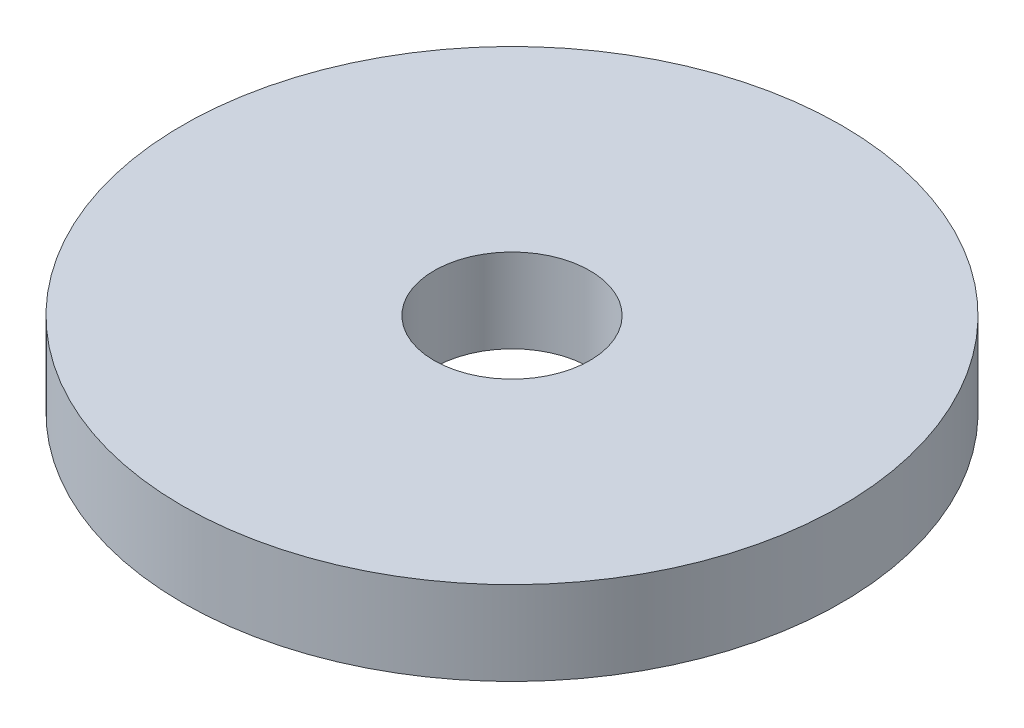
from build123d import *

# Parameters (mm, degrees)
SKETCH_1_R             = 5.5
EXTRUDE_1_DEPTH        = 1.4
HOLE_WIZARD_M2_1_D     = 2.6
HOLE_WIZARD_M2_1_DEPTH = 4
HOLE_WIZARD_M2_1_TIP   = 0.781118805


with BuildPart() as part:
    # 스케치1 → 보스-돌출1 (new body)
    with BuildSketch(Plane(origin=(0, 0, 0), x_dir=(1, 0, 0), z_dir=(0, 1, 0))):
        with Locations(Location((0, 0, 0), (0, 0, 270))):
            Circle(SKETCH_1_R)
    extrude(amount=EXTRUDE_1_DEPTH)

    # M2 여유 구멍1
    with Locations(Plane(origin=(0, 1.4, 0), x_dir=(1, 0, 0), z_dir=(0, 1, 0))):
        with Locations((0, 0)):
            Hole(HOLE_WIZARD_M2_1_D / 2, depth=HOLE_WIZARD_M2_1_DEPTH)
            with Locations((0, 0, -(HOLE_WIZARD_M2_1_DEPTH + HOLE_WIZARD_M2_1_TIP / 2))):  # 118° drill point
                Cone(0, HOLE_WIZARD_M2_1_D / 2, HOLE_WIZARD_M2_1_TIP, mode=Mode.SUBTRACT)


solid = part.part
